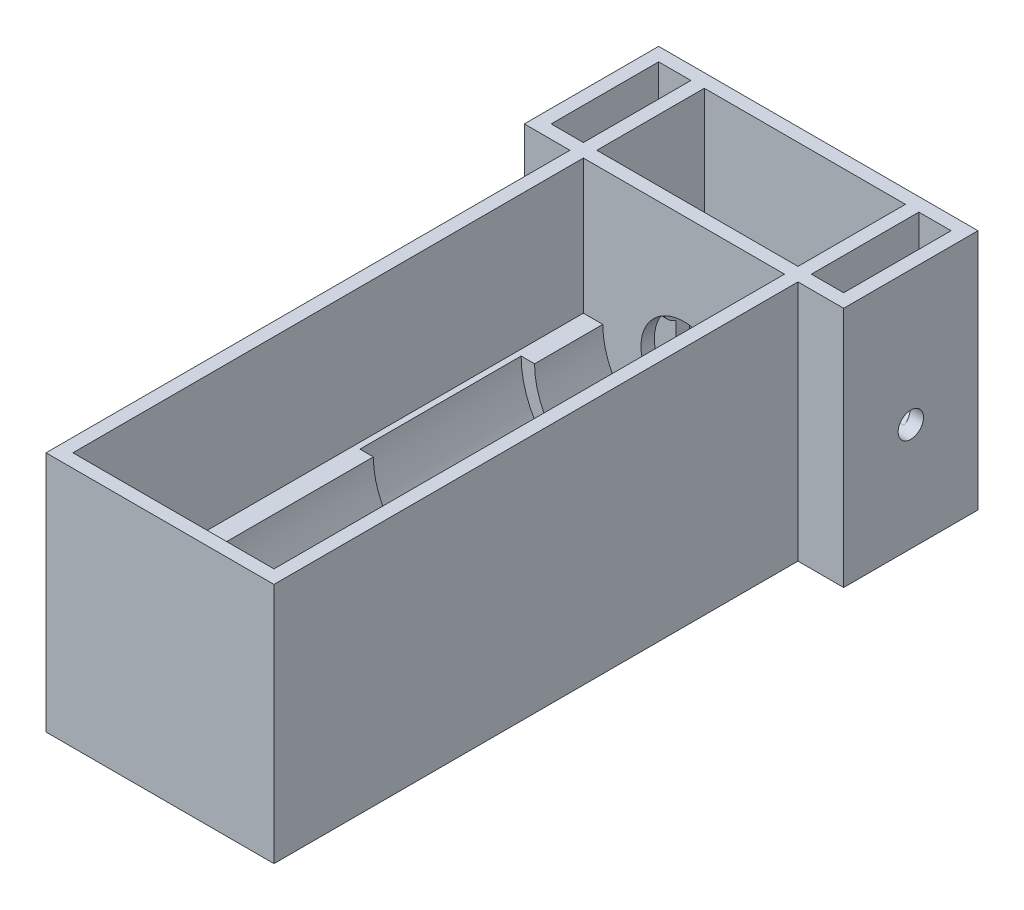
from build123d import *

# Parameters (mm, degrees)
BOSS_EXTRUDE1_DEPTH      = 12.7
SKETCH2_W                = 53.879496
SKETCH2_H                = 57.15
BOSS_EXTRUDE2_DEPTH      = 3.175
CUT_EXTRUDE2_DEPTH       = 66.145131417
CUT_EXTRUDE2_DEPTH_BACK  = 66.145131417
SKETCH3_R                = 3
SKETCH5_W                = 53.879496
SKETCH5_H                = 25.4
SKETCH5_R                = 3.4925
BOSS_EXTRUDE3_DEPTH      = 6.35
SKETCH7_W                = 7.62
SKETCH7_H                = 15.609396712
BOSS_EXTRUDE7_DEPTH      = 1.5875
SKETCH8_W                = 53.879496
SKETCH8_H                = 57.15
BOSS_EXTRUDE8_DEPTH      = 127
CUT_EXTRUDE7_DEPTH       = 154.323065852
CUT_EXTRUDE7_DEPTH_BACK  = 154.323065852
SKETCH13_W               = 0.002356984
SKETCH13_H               = 124.229061331
CUT_EXTRUDE8_START       = -31.75
SKETCH14_W               = 47.527139016
SKETCH14_H               = 120.65
CUT_EXTRUDE8_DEPTH       = 31.75
CUT_EXTRUDE9_DEPTH       = 4.229066359
SKETCH16_W               = 53.879496
SKETCH16_H               = 25.4
CUT_EXTRUDE10_DEPTH      = 152.071109158
SKETCH18_W               = 13.97
SKETCH18_H               = 31.75
SKETCH18_W_2             = 7.62
SKETCH18_H_2             = 25.4
BOSS_EXTRUDE10_DEPTH     = 57.15
BOSS_EXTRUDE11_START     = -34.559748
BOSS_EXTRUDE11_DEPTH     = 7.62
BOSS_EXTRUDE12_START     = 26.939748
BOSS_EXTRUDE12_DEPTH     = 7.62
CUT_EXTRUDE11_DEPTH      = 163.985890519
CUT_EXTRUDE11_DEPTH_BACK = 163.985890519
SKETCH20_R               = 3


with BuildPart() as part:
    # Sketch1 → Boss-Extrude1 (new, symmetric)
    with BuildSketch(Plane.XY):
        Polygon((-26.939748, 0), (26.939748, 0), (26.939748, 6.35), (26.939748, 57.15), (23.764748, 57.15), (23.764748, 6.35), (-23.764748, 6.35), (-23.764748, 57.15), (-26.939748, 57.15), (-26.939748, 6.35), align=None)
    extrude(amount=BOSS_EXTRUDE1_DEPTH, both=True)

    # Sketch2 → Boss-Extrude2 (add)
    with BuildSketch(Plane(origin=(0, 0, -12.7), x_dir=(-1, 0, 0), z_dir=(0, 0, -1))):
        with Locations((0, 28.575)):
            Rectangle(SKETCH2_W, SKETCH2_H)
    extrude(amount=BOSS_EXTRUDE2_DEPTH)

    # Sketch6 → Revolve2 (revolve)
    with BuildSketch(Plane.XY, mode=Mode.PRIVATE) as revolve2_sk:
        Polygon((-23.764748, 25.4), (-16.144748, 25.4), (-16.144748, 30.48), (-21.224748, 30.48), (-23.764748, 33.02), align=None)
        Polygon((23.764748, 33.02), (23.764748, 25.4), (16.144748, 25.4), (16.144748, 30.48), (21.224748, 30.48), align=None)
    revolve(revolve2_sk.sketch.rotate(Axis((-23.764748, 25.4, 0), (1, 0, 0)), 90), axis=Axis((-23.764748, 25.4, 0), (1, 0, 0)))

    # Sketch3 → Cut-Extrude2 (cut, two sides: drawn at the far end of the back side and taken through both)
    with BuildSketch(Plane(origin=(0, 0, 0), x_dir=(0, 0, -1), z_dir=(1, 0, 0)).offset(-CUT_EXTRUDE2_DEPTH_BACK)):
        with Locations((0, 25.4)):
            Circle(SKETCH3_R)
    extrude(amount=CUT_EXTRUDE2_DEPTH + CUT_EXTRUDE2_DEPTH_BACK, mode=Mode.SUBTRACT)

    # Sketch5 → Boss-Extrude3 (add)
    with BuildSketch(Plane.XZ):
        with Locations((0, -28.575)):
            Rectangle(SKETCH5_W, SKETCH5_H)
        with Locations(Location((7.889748, -28.575, 0), (0, 0, 270))):
            Circle(SKETCH5_R, mode=Mode.SUBTRACT)
        with Locations(Location((-17.510252, -28.575, 0), (0, 0, 270))):
            Circle(SKETCH5_R, mode=Mode.SUBTRACT)
    extrude(amount=-BOSS_EXTRUDE3_DEPTH)

    # Sketch7 → Boss-Extrude7 (add, symmetric)
    with BuildSketch(Plane.XY):
        with Locations((-19.954748, 14.154698356)):
            Rectangle(SKETCH7_W, SKETCH7_H)
        with Locations((19.954748, 14.154698356)):
            Rectangle(SKETCH7_W, SKETCH7_H)
    extrude(amount=BOSS_EXTRUDE7_DEPTH, both=True)

    # Sketch8 → Boss-Extrude8 (add)
    with BuildSketch(Plane.XY.offset(12.7)):
        with Locations((0, 28.575)):
            Rectangle(SKETCH8_W, SKETCH8_H)
    extrude(amount=BOSS_EXTRUDE8_DEPTH)

    # Sketch9 → Cut-Revolve1 (revolve, cut)
    with BuildSketch(Plane(origin=(0, 0, 0), x_dir=(0, 0, -1), z_dir=(1, 0, 0))):
        Polygon((-70.104, 47.752), (-70.104, 44.577), (-136.525, 44.577), (-136.525, 25.4), (-70.104, 25.4), (0, 25.4), (0, 35.56), (-20.104066359, 35.56), (-20.104066359, 44.577), (-32.004, 44.577), (-32.004, 47.752), align=None)
    revolve(axis=Axis((0, 25.4, 0), (0, 0, 1)), mode=Mode.SUBTRACT)

    # Sketch13 → Cut-Extrude7 (cut, two sides: drawn at the far end of the back side and taken through both)
    with BuildSketch(Plane(origin=(0, 0, 0), x_dir=(-1, 0, 0), z_dir=(0, -1, 0)).offset(-CUT_EXTRUDE7_DEPTH_BACK)):
        with Locations((26.940926492, -77.585469335)):
            Rectangle(SKETCH13_W, SKETCH13_H)
        with Locations((-26.938569508, -77.585469335)):
            Rectangle(SKETCH13_W, SKETCH13_H)
    extrude(amount=CUT_EXTRUDE7_DEPTH + CUT_EXTRUDE7_DEPTH_BACK, mode=Mode.SUBTRACT)

    # Sketch14 → Cut-Extrude8 (cut)
    with BuildSketch(Plane(origin=(0, 57.15, 0), x_dir=(1, 0, 0), z_dir=(0, 1, 0)).offset(CUT_EXTRUDE8_START)):
        with Locations((-0.001178492, -76.2)):
            Rectangle(SKETCH14_W, SKETCH14_H)
    extrude(amount=CUT_EXTRUDE8_DEPTH, mode=Mode.SUBTRACT)

    # Sketch15 → Cut-Extrude9 (cut)
    with BuildSketch(Plane.XY.offset(20.104066359)):
        with BuildLine():
            Line((-10.16, 25.4), (-19.177, 25.4))
            ThreePointArc((-19.177, 25.4), (0, 6.223), (19.177, 25.4))
            Line((19.177, 25.4), (10.16, 25.4))
            ThreePointArc((10.16, 25.4), (0, 15.24), (-10.16, 25.4))
        make_face()
    extrude(amount=-CUT_EXTRUDE9_DEPTH, mode=Mode.SUBTRACT)

    # Sketch16 → Cut-Extrude10 (cut, through all)
    with BuildSketch(Plane(origin=(0, 6.35, 0), x_dir=(1, 0, 0), z_dir=(0, 1, 0))):
        with Locations((0, 28.575)):
            Rectangle(SKETCH16_W, SKETCH16_H)
    extrude(amount=-CUT_EXTRUDE10_DEPTH, mode=Mode.SUBTRACT)

    # Sketch18 → Boss-Extrude10 (add)
    with BuildSketch(Plane(origin=(0, 0, 0), x_dir=(1, 0, 0), z_dir=(0, 1, 0))):
        with Locations((-30.749748, 0)):
            Rectangle(SKETCH18_W, SKETCH18_H)
        with Locations((-30.749748, 0)):
            Rectangle(SKETCH18_W_2, SKETCH18_H_2, mode=Mode.SUBTRACT)
    boss_extrude10 = extrude(amount=BOSS_EXTRUDE10_DEPTH)

    # Sketch19 → Boss-Extrude11 (add)
    with BuildSketch(Plane(origin=(0, 0, 0), x_dir=(0, 0, -1), z_dir=(1, 0, 0)).offset(BOSS_EXTRUDE11_START)):
        with BuildLine():
            Line((1.5875, 22.854446278), (12.7, 29.784605952))
            Line((12.7, 29.784605952), (12.7, 0))
            Line((12.7, 0), (-12.7, 0))
            Line((-12.7, 0), (-12.7, 29.784605952))
            Line((-12.7, 29.784605952), (-1.5875, 22.854446278))
            ThreePointArc((-1.5875, 22.854446278), (0, 22.4), (1.5875, 22.854446278))
        make_face()
    extrude(amount=BOSS_EXTRUDE11_DEPTH)

    # Mirror4: Boss-Extrude10 across plane
    add(boss_extrude10.mirror(Plane(origin=(0, 0, 0), x_dir=(0, 0, 1), z_dir=(1, 0, 0))))

    # Sketch19<2> → Boss-Extrude12 (add)
    with BuildSketch(Plane(origin=(0, 0, 0), x_dir=(0, 0, -1), z_dir=(1, 0, 0)).offset(BOSS_EXTRUDE12_START)):
        with BuildLine():
            Line((1.5875, 22.854446278), (12.7, 29.784605952))
            Line((12.7, 29.784605952), (12.7, 0))
            Line((12.7, 0), (-12.7, 0))
            Line((-12.7, 0), (-12.7, 29.784605952))
            Line((-12.7, 29.784605952), (-1.5875, 22.854446278))
            ThreePointArc((-1.5875, 22.854446278), (0, 22.4), (1.5875, 22.854446278))
        make_face()
    extrude(amount=BOSS_EXTRUDE12_DEPTH)

    # Sketch20 → Cut-Extrude11 (cut, two sides: drawn at the far end of the back side and taken through both)
    with BuildSketch(Plane(origin=(-23.764748, 0, 0), x_dir=(0, 0, -1), z_dir=(1, 0, 0)).offset(-CUT_EXTRUDE11_DEPTH_BACK)):
        with Locations((0, 25.4)):
            Circle(SKETCH20_R)
    extrude(amount=CUT_EXTRUDE11_DEPTH + CUT_EXTRUDE11_DEPTH_BACK, mode=Mode.SUBTRACT)


solid = part.part
